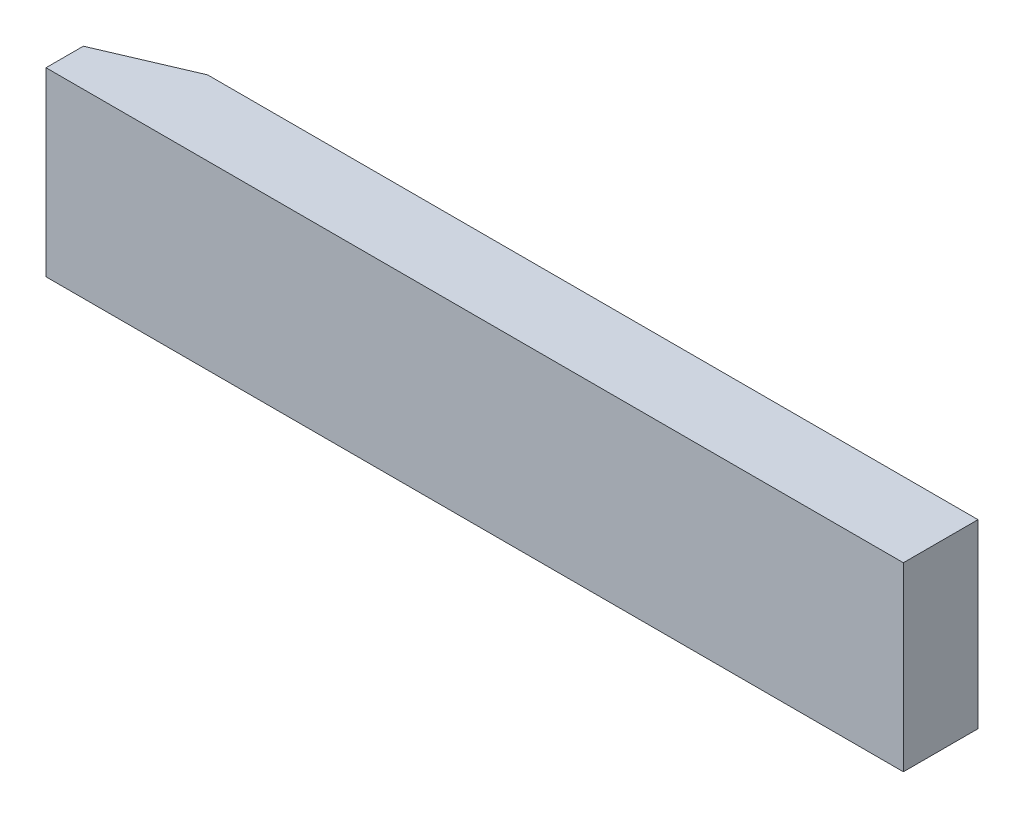
from build123d import *

# Parameters (mm, degrees)
SKETCH1_W           = 120.25981376
SKETCH1_H           = 10.466297785
BOSS_EXTRUDE1_DEPTH = 25.4
CUT_EXTRUDE1_DEPTH  = 124.357716398


with BuildPart() as part:
    # Sketch1 → Boss-Extrude1 (new body)
    with BuildSketch(Plane(origin=(0, 0, 0), x_dir=(1, 0, 0), z_dir=(0, 1, 0))):
        with Locations((60.12990688, 5.233148893)):
            Rectangle(SKETCH1_W, SKETCH1_H)
    extrude(amount=BOSS_EXTRUDE1_DEPTH)

    # Sketch2 → Cut-Extrude1 (cut, through all)
    with BuildSketch(Plane(origin=(0, 25.4, 0), x_dir=(1, 0, 0), z_dir=(0, 1, 0))):
        Polygon((0, 5.233148892), (12.197444829, 10.466297785), (0, 10.466297785), align=None)
    extrude(amount=-CUT_EXTRUDE1_DEPTH, mode=Mode.SUBTRACT)


solid = part.part
